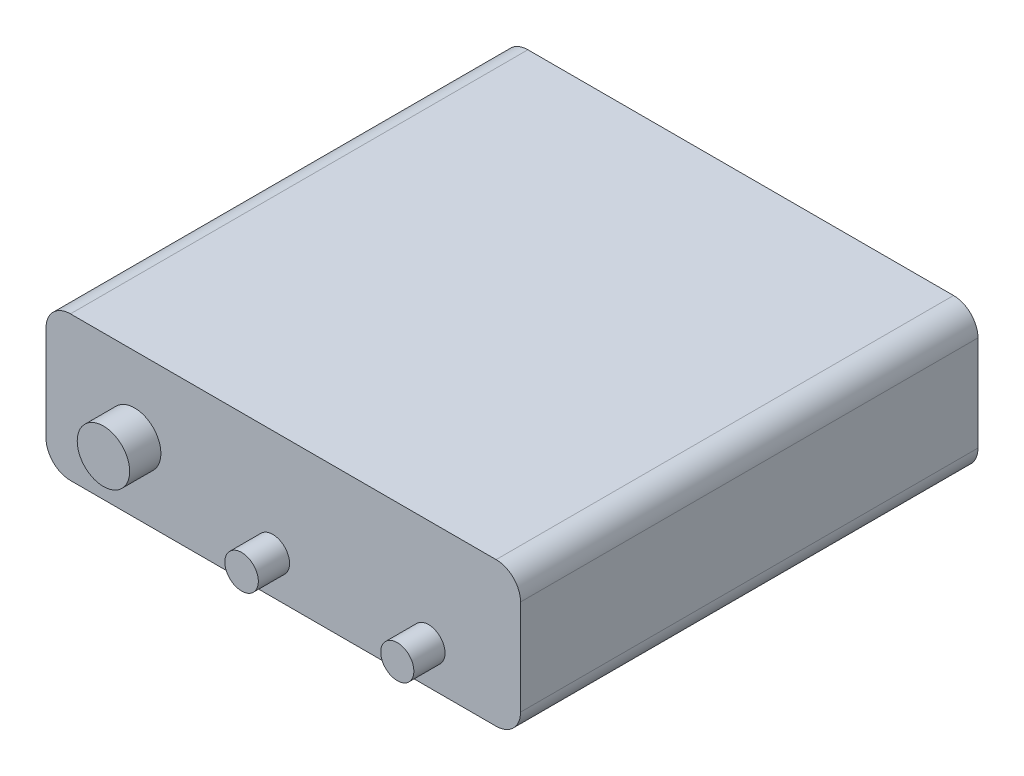
from build123d import *

# Parameters (mm, degrees)
SKETCH1_W           = 197.104
SKETCH1_H           = 189.992
BOSS_EXTRUDE1_DEPTH = 59.944
FILLET1_R           = 10.16
FILLET2_R           = 10.16
FILLET3_R           = 10.16
FILLET4_R           = 10.16
SKETCH2_R           = 10.892824913
SKETCH2_R_2         = 6.956698316
SKETCH2_R_3         = 6.871617304
BOSS_EXTRUDE3_DEPTH = 12.954


with BuildPart() as part:
    # Sketch1 → Boss-Extrude1 (new body)
    with BuildSketch(Plane(origin=(0, 0, 0), x_dir=(1, 0, 0), z_dir=(0, 1, 0))):
        with Locations((-98.552, -94.996)):
            Rectangle(SKETCH1_W, SKETCH1_H)
    extrude(amount=BOSS_EXTRUDE1_DEPTH)

    # Fillet1
    fillet1_edges = [part.edges().sort_by_distance(p)[0] for p in [
        (0, 59.944, 94.996),
    ]]
    fillet(fillet1_edges, radius=FILLET1_R)

    # Fillet2
    fillet2_edges = [part.edges().sort_by_distance(p)[0] for p in [
        (0, 0, 94.996),
    ]]
    fillet(fillet2_edges, radius=FILLET2_R)

    # Fillet3
    fillet3_edges = [part.edges().sort_by_distance(p)[0] for p in [
        (-197.104, 59.944, 94.996),
    ]]
    fillet(fillet3_edges, radius=FILLET3_R)

    # Fillet4
    fillet4_edges = [part.edges().sort_by_distance(p)[0] for p in [
        (-197.104, 0, 94.996),
    ]]
    fillet(fillet4_edges, radius=FILLET4_R)

    # Sketch2 → Boss-Extrude3 (add)
    with BuildSketch(Plane.XY.offset(189.992)):
        with Locations(Location((-160.289066684, 28.528637542, 0), (0, 0, 180))):
            Circle(SKETCH2_R)
        with Locations(Location((-102.910266874, 15.674726269, 0), (0, 0, 180))):
            Circle(SKETCH2_R_2)
        with Locations(Location((-38.243166858, 15.674726269, 0), (0, 0, 180))):
            Circle(SKETCH2_R_3)
    extrude(amount=BOSS_EXTRUDE3_DEPTH)


solid = part.part
